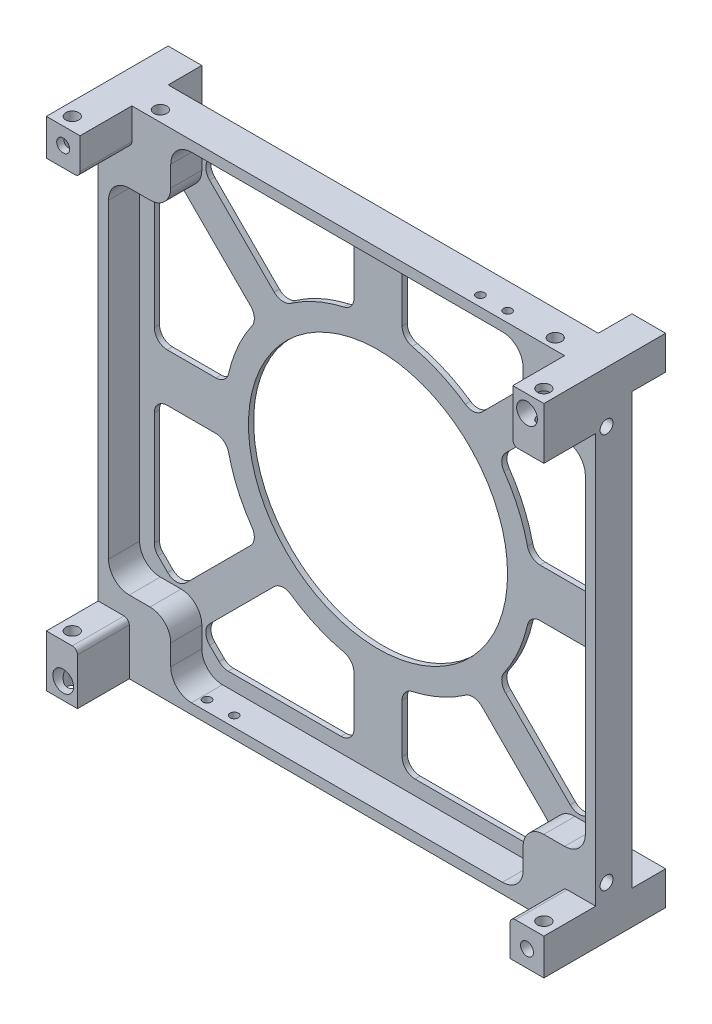
from build123d import *

# Parameters (mm, degrees)
BOSS_EXTRUDE2_DEPTH                     = 1
CIRPATTERN3_COUNT                       = 4
SKETCH2_W                               = 6.5
SKETCH2_H                               = 6.5
BOSS_EXTRUDE3_DEPTH                     = 6.5
SKETCH4_W                               = 96
SKETCH4_H                               = 96
BOSS_EXTRUDE4_DEPTH                     = 6
SKETCH5_W                               = 6.5
SKETCH5_H                               = 7
SKETCH5_W_2                             = 6
SKETCH5_H_2                             = 10
BOSS_EXTRUDE5_DEPTH                     = 10
M3_TAPPED_RAILHOLES_AT_2_COUNT          = 2
M3_TAPPED_RAILHOLES_AT_2_PITCH          = 91
SIDEPLATEHOLES_COUNT                    = 4
M2X0_4_TAPPED_HOLE1_AT_2_COUNT          = 2
M2X0_4_TAPPED_HOLE1_AT_2_PITCH          = 5.25
LIMITSWITCHHOLES_COUNT                  = 2
FILLET2_R                               = 4
M3_TAPPED_STANDOFF_HOLE_D               = 2.5
STANDOFFHOLES_COUNT                     = 4
SKETCH26_R                              = 1.7
BOSS_EXTRUDE6_DEPTH                     = 3
M1_6X0_35_TAPPED_HOLE1_AT_2_COUNT       = 2
M1_6X0_35_TAPPED_HOLE1_AT_2_PITCH       = 75
CBORE_FOR_M5_HEX_HEAD_BOLT1_D           = 2
CBORE_FOR_M5_HEX_HEAD_BOLT1_CBORE_D     = 4
CBORE_FOR_M5_HEX_HEAD_BOLT1_CBORE_DEPTH = 10
CIRPATTERN4_COUNT                       = 2
FILLET3_R                               = 1


with BuildPart() as part:
    # Sketch3 → Boss-Extrude2 (new body)
    with BuildSketch(Plane.XY):
        with BuildLine():
            Line((48, 48), (0, 48))
            Line((0, 48), (0, 25))
            ThreePointArc((0, 25), (17.67766953, 17.67766953), (25, 0))
            Line((25, 0), (48, 0))
            Line((48, 0), (48, 48))
        make_face()
        with BuildLine():
            Line((4.64, 40.68), (4.64, 31.275338527))
            ThreePointArc((4.64, 31.275338527), (5.185383207, 29.716661783), (6.583578554, 28.838045936))
            ThreePointArc((6.583578554, 28.838045936), (11.929970388, 27.067548957), (16.843891651, 24.31583258))
            ThreePointArc((16.843891651, 24.31583258), (18.491652526, 23.880994223), (20.035246471, 24.603156278))
            Line((20.035246471, 24.603156278), (32.512233047, 37.080142853))
            ThreePointArc((32.512233047, 37.080142853), (33.244466094, 38.847909806), (32.512233047, 40.615676759))
            Line((32.512233047, 40.615676759), (30.680142853, 42.447766953))
            ThreePointArc((30.680142853, 42.447766953), (29.869084481, 42.989698831), (28.912375901, 43.18))
            Line((28.912375901, 43.18), (7.14, 43.18))
            ThreePointArc((7.14, 43.18), (5.372233047, 42.447766953), (4.64, 40.68))
        make_face(mode=Mode.SUBTRACT)
        with BuildLine():
            Line((24.603156278, 20.035246471), (37.080142853, 32.512233047))
            ThreePointArc((37.080142853, 32.512233047), (38.847909806, 33.244466094), (40.615676759, 32.512233047))
            Line((40.615676759, 32.512233047), (42.447766953, 30.680142853))
            ThreePointArc((42.447766953, 30.680142853), (42.989698831, 29.869084481), (43.18, 28.912375901))
            Line((43.18, 28.912375901), (43.18, 7.14))
            ThreePointArc((43.18, 7.14), (42.447766953, 5.372233047), (40.68, 4.64))
            Line((40.68, 4.64), (31.275338527, 4.64))
            ThreePointArc((31.275338527, 4.64), (29.716661783, 5.185383207), (28.838045936, 6.583578554))
            ThreePointArc((28.838045936, 6.583578554), (27.067548957, 11.929970388), (24.31583258, 16.843891651))
            ThreePointArc((24.31583258, 16.843891651), (23.880994223, 18.491652526), (24.603156278, 20.035246471))
        make_face(mode=Mode.SUBTRACT)
    boss_extrude2 = extrude(amount=BOSS_EXTRUDE2_DEPTH)

    # CirPattern3: Boss-Extrude2 ×4 about axis
    cirpattern3_axis = Axis((0, 0, 7.875), (0, 0, -1))
    for i in range(1, CIRPATTERN3_COUNT):
        add(boss_extrude2.rotate(cirpattern3_axis, i * 360 / CIRPATTERN3_COUNT))

    # Sketch2 → Boss-Extrude3 (add)
    with BuildSketch(Plane.XY):
        with Locations((44.75, 44.75)):
            Rectangle(SKETCH2_W, SKETCH2_H)
        with Locations((44.75, -44.75)):
            Rectangle(SKETCH2_W, SKETCH2_H)
        with Locations((-44.75, -44.75)):
            Rectangle(SKETCH2_W, SKETCH2_H)
        with Locations((-44.75, 44.75)):
            Rectangle(SKETCH2_W, SKETCH2_H)
    extrude(amount=-BOSS_EXTRUDE3_DEPTH)

    # Sketch4 → Boss-Extrude4 (add)
    with BuildSketch(Plane.XY.offset(1)):
        Rectangle(SKETCH4_W, SKETCH4_H)
        Polygon((46, -34), (46, 34), (34, 34), (34, 46), (-34, 46), (-34, 34), (-46, 34), (-46, -34), (-34, -34), (-34, -46), (34, -46), (34, -34), align=None, mode=Mode.SUBTRACT)
    extrude(amount=BOSS_EXTRUDE4_DEPTH)

    # Sketch5 → Boss-Extrude5 (add)
    with BuildSketch(Plane.XY.offset(7)):
        with Locations((-44.75, 44.5)):
            Rectangle(SKETCH5_W, SKETCH5_H)
        with Locations((45, 43)):
            Rectangle(SKETCH5_W_2, SKETCH5_H_2)
        with Locations((-45, -43)):
            Rectangle(SKETCH5_W_2, SKETCH5_H_2)
        with Locations((44.75, -44.5)):
            Rectangle(SKETCH5_W, SKETCH5_H)
    extrude(amount=BOSS_EXTRUDE5_DEPTH)

    # Sketch13 → M3 Tapped RailHoles (revolve, cut)
    with BuildSketch(Plane(origin=(45.5, 48, 14.5), x_dir=(0, 0, 1), z_dir=(1, 0, 0))):
        Polygon((0, 0), (0, 13.251075774), (1.25, 12.5), (1.25, 0), align=None)
    m3_tapped_railholes = revolve(axis=Axis((45.5, 54.35, 14.5), (0, -1, 0)), mode=Mode.SUBTRACT)

    # M3 Tapped RailHoles at 2: M3 Tapped RailHoles ×2
    with Locations(*[(-i * M3_TAPPED_RAILHOLES_AT_2_PITCH, 0, 0) for i in range(1, M3_TAPPED_RAILHOLES_AT_2_COUNT)]):
        add(m3_tapped_railholes, mode=Mode.SUBTRACT)

    # RailHoles: M3 Tapped RailHoles across plane
    add(m3_tapped_railholes.mirror(Plane.ZX), mode=Mode.SUBTRACT)

    # RailHoles copy 1 sketch → RailHoles copy 1 (revolve, cut)
    with BuildSketch(Plane(origin=(-45.5, -48, 14.5), x_dir=(0, 0, 1), z_dir=(1, 0, 0))):
        Polygon((0, 0), (0, -13.251075774), (1.25, -12.5), (1.25, 0), align=None)
    revolve(axis=Axis((-45.5, -54.35, 14.5), (0, -1, 0)), mode=Mode.SUBTRACT)

    # Sketch17 → M3x0.5 Tapped SidePlate (revolve, cut)
    with BuildSketch(Plane(origin=(-38.1, -48, 4.9), x_dir=(0, 0, -1), z_dir=(1, 0, 0))):
        Polygon((0, 0), (0, 8.251075774), (1.25, 7.5), (1.25, 0), align=None)
    m3x0_5_tapped_sideplate = revolve(axis=Axis((-38.1, -54.35, 4.9), (0, 1, 0)), mode=Mode.SUBTRACT)

    # Sketch19 → M3x0.5 Tapped SidePlate2 (revolve, cut)
    with BuildSketch(Plane(origin=(-48, -38.1, 4.9), x_dir=(0, 0, 1), z_dir=(0, 1, 0))):
        Polygon((0, 0), (0, 8.251075774), (1.25, 7.5), (1.25, 0), align=None)
    m3x0_5_tapped_sideplate2 = revolve(axis=Axis((-54.35, -38.1, 4.9), (1, 0, 0)), mode=Mode.SUBTRACT)

    # SidePlateHoles: M3x0.5 Tapped SidePlate, M3x0.5 Tapped SidePlate2 ×4 about axis
    sideplateholes_axis = Axis((0, 0, 1), (0, 0, -1))
    add([m3x0_5_tapped_sideplate.rotate(sideplateholes_axis, i * 360 / SIDEPLATEHOLES_COUNT) for i in range(1, SIDEPLATEHOLES_COUNT)], mode=Mode.SUBTRACT)
    add([m3x0_5_tapped_sideplate2.rotate(sideplateholes_axis, i * 360 / SIDEPLATEHOLES_COUNT) for i in range(1, SIDEPLATEHOLES_COUNT)], mode=Mode.SUBTRACT)

    # Sketch21 → M2x0.4 Tapped Hole1 (revolve, cut)
    with BuildSketch(Plane(origin=(-29, -48, 5), x_dir=(0, 0, -1), z_dir=(1, 0, 0))):
        Polygon((0, 0), (0, 5.680688495), (0.8, 5.2), (0.8, 0), align=None)
    m2x0_4_tapped_hole1 = revolve(axis=Axis((-29, -54.35, 5), (0, 1, 0)), mode=Mode.SUBTRACT)

    # M2x0.4 Tapped Hole1 at 2: M2x0.4 Tapped Hole1 ×2
    with Locations(*[(i * M2X0_4_TAPPED_HOLE1_AT_2_PITCH, 0, 0) for i in range(1, M2X0_4_TAPPED_HOLE1_AT_2_COUNT)]):
        add(m2x0_4_tapped_hole1, mode=Mode.SUBTRACT)

    # LimitSwitchHoles: M2x0.4 Tapped Hole1 ×2 about axis
    limitswitchholes_axis = Axis((0, 0, 1), (0, 0, -1))
    for i in range(1, LIMITSWITCHHOLES_COUNT):
        add(m2x0_4_tapped_hole1.rotate(limitswitchholes_axis, i * 360 / LIMITSWITCHHOLES_COUNT), mode=Mode.SUBTRACT)

    # LimitSwitchHoles copy 1 sketch → LimitSwitchHoles copy 1 (revolve, cut)
    with BuildSketch(Plane(origin=(23.75, 48, 5), x_dir=(0, 0, -1), z_dir=(-1, 0, 0))):
        Polygon((0, 0), (0, 5.680688495), (0.8, 5.2), (0.8, 0), align=None)
    revolve(axis=Axis((23.75, 54.35, 5), (0, -1, 0)), mode=Mode.SUBTRACT)

    # Fillet2
    fillet2_edges = [part.edges().sort_by_distance(p)[0] for p in [
        (-46, -34, 4),
        (-34, -34, 4),
        (-34, -46, 4),
        (34, -46, 4),
        (34, -34, 4),
        (46, -34, 4),
        (46, 34, 4),
        (34, 34, 4),
        (34, 46, 4),
        (-34, 46, 4),
        (-34, 34, 4),
        (-46, 34, 4),
    ]]
    fillet(fillet2_edges, radius=FILLET2_R)

    # M3 Tapped Standoff Hole (through all)
    with Locations(Plane.XY.offset(17)):
        with Locations((44.75, 44.75)):
            m3_tapped_standoff_hole = Hole(M3_TAPPED_STANDOFF_HOLE_D / 2)

    # StandoffHoles: M3 Tapped Standoff Hole ×4 about axis
    standoffholes_axis = Axis((0, 0, 1), (0, 0, -1))
    for i in range(1, STANDOFFHOLES_COUNT):
        add(m3_tapped_standoff_hole.rotate(standoffholes_axis, i * 360 / STANDOFFHOLES_COUNT), mode=Mode.SUBTRACT)

    # Sketch26 → Boss-Extrude6 (add)
    with BuildSketch(Plane(origin=(0, 0, 0), x_dir=(-1, 0, 0), z_dir=(0, 0, -1))):
        with Locations((40, -37.5)):
            Circle(SKETCH26_R)
        with Locations((40, 37.5)):
            Circle(SKETCH26_R)
    boss_extrude6 = extrude(amount=BOSS_EXTRUDE6_DEPTH)

    # Sketch31 → M1.6x0.35 Tapped Hole1 (revolve, cut)
    with BuildSketch(Plane(origin=(-40, -37.5, -3), x_dir=(0, 1, 0), z_dir=(1, 0, 0))):
        Polygon((0, 0), (0, 3.375537887), (0.625, 3), (0.625, 0), align=None)
    m1_6x0_35_tapped_hole1 = revolve(axis=Axis((-40, -37.5, -9.35), (0, 0, 1)), mode=Mode.SUBTRACT)

    # M1.6x0.35 Tapped Hole1 at 2: M1.6x0.35 Tapped Hole1 ×2
    with Locations(*[(0, i * M1_6X0_35_TAPPED_HOLE1_AT_2_PITCH, 0) for i in range(1, M1_6X0_35_TAPPED_HOLE1_AT_2_COUNT)]):
        add(m1_6x0_35_tapped_hole1, mode=Mode.SUBTRACT)

    # BottomHoles: Boss-Extrude6, M1.6x0.35 Tapped Hole1 across plane
    add(boss_extrude6.mirror(Plane(origin=(0, 0, 0), x_dir=(0, 0, 1), z_dir=(1, 0, 0))))
    add(m1_6x0_35_tapped_hole1.mirror(Plane(origin=(0, 0, 0), x_dir=(0, 0, 1), z_dir=(1, 0, 0))), mode=Mode.SUBTRACT)

    # BottomHoles copy 1 sketch → BottomHoles copy 1 (revolve, cut)
    with BuildSketch(Plane(origin=(40, 37.5, -3), x_dir=(0, 1, 0), z_dir=(-1, 0, 0))):
        Polygon((0, 0), (0, -3.375537887), (0.625, -3), (0.625, 0), align=None)
    revolve(axis=Axis((40, 37.5, -9.35), (0, 0, -1)), mode=Mode.SUBTRACT)

    # CBORE for M5 Hex Head Bolt1 (through all)
    with Locations(Plane.XY.offset(17)):
        with Locations((44.75, 44.75)):
            cbore_for_m5_hex_head_bolt1 = CounterBoreHole(CBORE_FOR_M5_HEX_HEAD_BOLT1_D / 2, CBORE_FOR_M5_HEX_HEAD_BOLT1_CBORE_D / 2, CBORE_FOR_M5_HEX_HEAD_BOLT1_CBORE_DEPTH)

    # CirPattern4: CBORE for M5 Hex Head Bolt1 ×2 about axis
    cirpattern4_axis = Axis((0, 0, 7.875), (0, 0, -1))
    for i in range(1, CIRPATTERN4_COUNT):
        add(cbore_for_m5_hex_head_bolt1.rotate(cirpattern4_axis, i * 360 / CIRPATTERN4_COUNT), mode=Mode.SUBTRACT)

    # Fillet3
    fillet3_edges = [part.edges().sort_by_distance(p)[0] for p in [
        (42, 38, 12),
        (-41.5, 41, 12),
        (-42, -38, 12),
        (41.5, -41, 12),
    ]]
    fillet(fillet3_edges, radius=FILLET3_R)


solid = part.part
